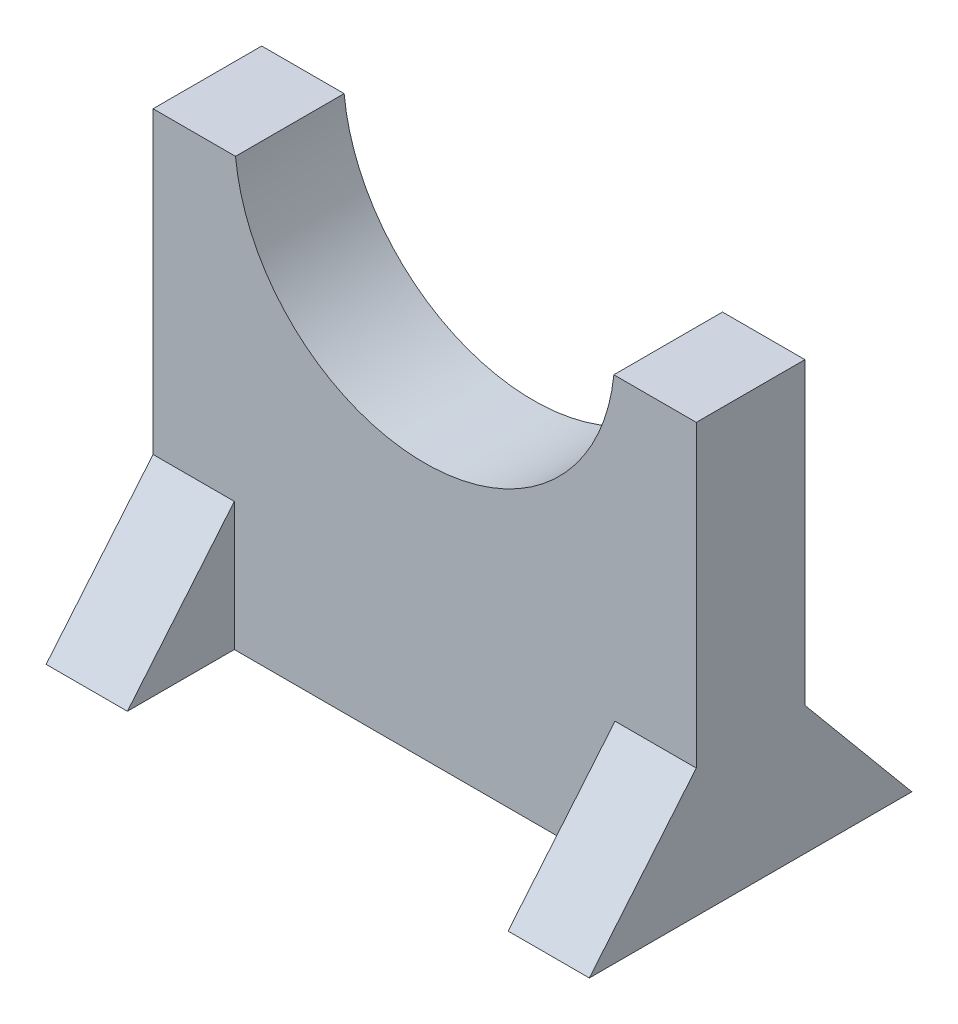
from build123d import *

# Parameters (mm, degrees)
SKETCH1_W           = 127
SKETCH1_H           = 25.4
BOSS_EXTRUDE1_DEPTH = 100
SKETCH2_R           = 44.45
CUT_EXTRUDE1_DEPTH  = 30
SKETCH3_W           = 19
SKETCH3_H           = 25
BOSS_EXTRUDE2_DEPTH = 30
CUT_EXTRUDE2_DEPTH  = 140


with BuildPart() as part:
    # Sketch1 → Boss-Extrude1 (new body)
    with BuildSketch(Plane(origin=(0, 0, 0), x_dir=(1, 0, 0), z_dir=(0, 1, 0))):
        Rectangle(SKETCH1_W, SKETCH1_H)
    extrude(amount=BOSS_EXTRUDE1_DEPTH)

    # Sketch2 → Cut-Extrude1 (cut)
    with BuildSketch(Plane.XY.offset(12.7)):
        with Locations((0, 104.45)):
            Circle(SKETCH2_R)
    extrude(amount=-CUT_EXTRUDE1_DEPTH, mode=Mode.SUBTRACT)

    # Sketch3 → Boss-Extrude2 (add)
    with BuildSketch(Plane(origin=(0, 0, 0), x_dir=(1, 0, 0), z_dir=(0, 1, 0))):
        with Locations((-54, 25.2)):
            Rectangle(SKETCH3_W, SKETCH3_H)
        with Locations((54, 25.2)):
            Rectangle(SKETCH3_W, SKETCH3_H)
        with Locations((54, -25.2)):
            Rectangle(SKETCH3_W, SKETCH3_H)
        with Locations((-54, -25.2)):
            Rectangle(SKETCH3_W, SKETCH3_H)
    extrude(amount=BOSS_EXTRUDE2_DEPTH)

    # Sketch4 → Cut-Extrude2 (cut)
    with BuildSketch(Plane.ZY.offset(63.5)):
        Polygon((12.7, 30), (37.7, 0), (37.7, 30), align=None)
        Polygon((-12.7, 30), (-37.7, 0), (-37.7, 30), align=None)
    extrude(amount=-CUT_EXTRUDE2_DEPTH, mode=Mode.SUBTRACT)


solid = part.part
